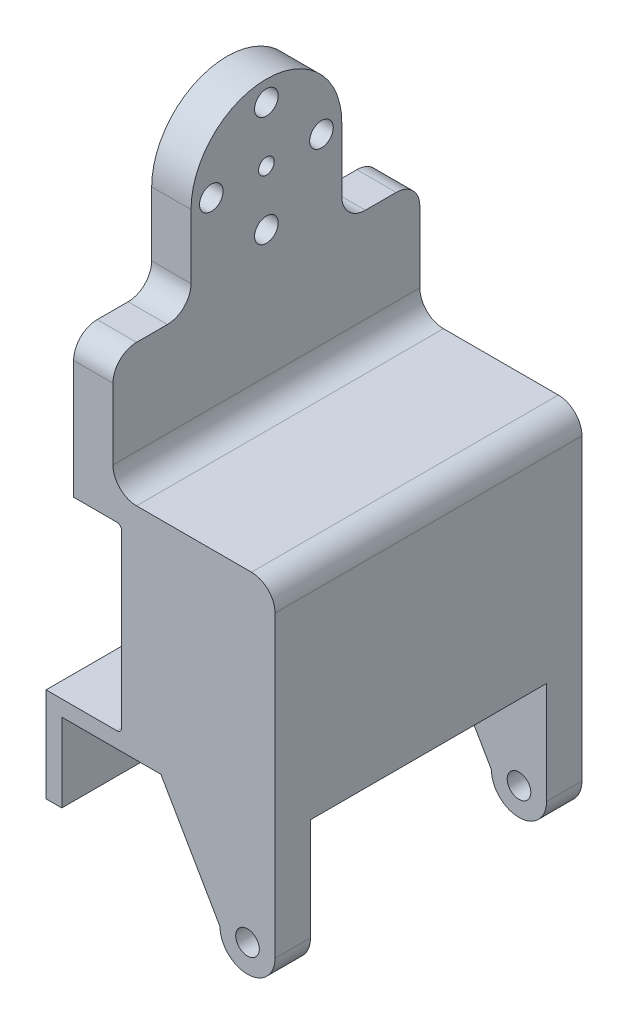
from build123d import *

# Parameters (mm, degrees)
BOSS_EXTRUDE1_DEPTH      = 19.5
SKETCH3_W                = 2
SKETCH3_H                = 39
BOSS_EXTRUDE2_DEPTH      = 10
SKETCH4_R                = 2.5
CUT_EXTRUDE3_DEPTH       = 10
SKETCH5_W                = 5.1
SKETCH5_H                = 22.95
BOSS_EXTRUDE3_DEPTH      = 25.1
SKETCH8_W                = 15.5
SKETCH8_H                = 22.95
BOSS_EXTRUDE4_DEPTH      = 33.9
BOSS_EXTRUDE5_DEPTH      = 19.5
SKETCH12_W               = 30.263636296
SKETCH12_H               = 30
CUT_EXTRUDE6_DEPTH       = 16.5
SKETCH13_R               = 1.5
CUT_EXTRUDE7_DEPTH       = 64.966273157
FILLET3_R                = 3
SKETCH16_W               = 39
SKETCH16_H               = 3.05
BOSS_EXTRUDE6_DEPTH      = 25.1
SKETCH17_W               = 5
SKETCH17_H               = 39
BOSS_EXTRUDE7_DEPTH      = 15
FILLET4_R                = 3
FILLET11_R               = 0.6
FILLET12_R               = 0.6
SKETCH18_W               = 5
SKETCH18_H               = 19.16
BOSS_EXTRUDE12_DEPTH     = 25.725
CUT_EXTRUDE13_DEPTH      = 73.504038681
CUT_EXTRUDE13_DEPTH_BACK = 73.504038681
CUT_EXTRUDE14_DEPTH      = 73.504038681
FILLET15_R               = 3
FILLET16_R               = 3
FILLET17_R               = 3
FILLET18_R               = 3
SKETCH23_W               = 3.5
SKETCH23_H               = 39
CUT_EXTRUDE15_DEPTH      = 26


with BuildPart() as part:
    # Sketch1 → Boss-Extrude1 (new, symmetric)
    with BuildSketch(Plane.XY):
        Polygon((-18.427969187, 26), (-18.427969187, 0), (-43.527969187, 0), (-43.527969187, -2), (-14.427969187, -2), (-14.427969187, 26), align=None)
    extrude(amount=BOSS_EXTRUDE1_DEPTH, both=True)

    # Sketch3 → Boss-Extrude2 (add)
    with BuildSketch(Plane(origin=(0, -2, 0), x_dir=(1, 0, 0), z_dir=(0, 1, 0))):
        with Locations((-42.527969187, 0)):
            Rectangle(SKETCH3_W, SKETCH3_H)
    extrude(amount=-BOSS_EXTRUDE2_DEPTH)

    # Sketch4 → Cut-Extrude3 (cut)
    with BuildSketch(Plane(origin=(-41.527969187, 0, 0), x_dir=(0, 0, -1), z_dir=(1, 0, 0))):
        with Locations((0, -7)):
            Circle(SKETCH4_R)
    extrude(amount=-CUT_EXTRUDE3_DEPTH, mode=Mode.SUBTRACT)

    # Sketch5 → Boss-Extrude3 (add)
    with BuildSketch(Plane.ZY.offset(18.427969187)):
        with Locations((-16.95, 11.475)):
            Rectangle(SKETCH5_W, SKETCH5_H)
    extrude(amount=BOSS_EXTRUDE3_DEPTH)

    # Sketch8 → Boss-Extrude4 (add)
    with BuildSketch(Plane.XY.offset(-14.4)):
        with Locations((-26.177969187, 11.475)):
            Rectangle(SKETCH8_W, SKETCH8_H)
    extrude(amount=BOSS_EXTRUDE4_DEPTH)

    # Sketch11 → Boss-Extrude5 (add, symmetric)
    with BuildSketch(Plane.XY):
        with BuildLine():
            Line((-14.427969187, -2), (-14.427969187, -15))
            ThreePointArc((-14.427969187, -15), (-17.927969187, -18.5), (-21.427969187, -15))
            Line((-21.427969187, -15), (-28.933522687, -2))
            Line((-28.933522687, -2), (-14.427969187, -2))
        make_face()
    extrude(amount=BOSS_EXTRUDE5_DEPTH, both=True)

    # Sketch12 → Cut-Extrude6 (cut)
    with BuildSketch(Plane(origin=(0, -18.5, 0), x_dir=(1, 0, 0), z_dir=(0, 1, 0))):
        with Locations((-18.965310336, 0)):
            Rectangle(SKETCH12_W, SKETCH12_H)
    extrude(amount=CUT_EXTRUDE6_DEPTH, mode=Mode.SUBTRACT)

    # Sketch13 → Cut-Extrude7 (cut, through all)
    with BuildSketch(Plane.XY.offset(19.5)):
        with Locations((-17.927969187, -15)):
            Circle(SKETCH13_R)
    extrude(amount=-CUT_EXTRUDE7_DEPTH, mode=Mode.SUBTRACT)

    # Fillet3
    fillet3_edges = [part.edges().sort_by_distance(p)[0] for p in [
        (-14.427969187, 26, 0),
    ]]
    fillet(fillet3_edges, radius=FILLET3_R)

    # Sketch16 → Boss-Extrude6 (add)
    with BuildSketch(Plane.ZY.offset(18.427969187)):
        with Locations((0, 24.475)):
            Rectangle(SKETCH16_W, SKETCH16_H)
    extrude(amount=BOSS_EXTRUDE6_DEPTH)

    # Sketch17 → Boss-Extrude7 (add)
    with BuildSketch(Plane(origin=(0, 26, 0), x_dir=(1, 0, 0), z_dir=(0, 1, 0))):
        with Locations((-37.527969187, 0)):
            Rectangle(SKETCH17_W, SKETCH17_H)
    extrude(amount=BOSS_EXTRUDE7_DEPTH)

    # Fillet4
    fillet4_edges = [part.edges().sort_by_distance(p)[0] for p in [
        (-35.027969187, 26, 0),
    ]]
    fillet(fillet4_edges, radius=FILLET4_R)

    # Fillet11
    fillet11_edges = [part.edges().sort_by_distance(p)[0] for p in [
        (-33.927969187, 22.95, 2.55),
    ]]
    fillet(fillet11_edges, radius=FILLET11_R)

    # Fillet12
    fillet12_edges = [part.edges().sort_by_distance(p)[0] for p in [
        (-33.927969187, 0, 2.55),
    ]]
    fillet(fillet12_edges, radius=FILLET12_R)

    # Sketch18 → Boss-Extrude12 (add)
    with BuildSketch(Plane(origin=(0, 41, 0), x_dir=(1, 0, 0), z_dir=(0, 1, 0))):
        with Locations((-37.527969187, 0)):
            Rectangle(SKETCH18_W, SKETCH18_H)
    extrude(amount=BOSS_EXTRUDE12_DEPTH)

    # Sketch20 → Cut-Extrude13 (cut, two sides: drawn at the far end of the back side and taken through both)
    with BuildSketch(Plane(origin=(-35.027969187, 0, 0), x_dir=(0, 0, -1), z_dir=(1, 0, 0)).offset(-CUT_EXTRUDE13_DEPTH_BACK)):
        with BuildLine():
            ThreePointArc((0, 46.65), (-1.5, 45.15), (0, 43.65))
            ThreePointArc((0, 43.65), (1.5, 45.15), (0, 46.65))
        make_face()
        with BuildLine():
            ThreePointArc((-7, 53.65), (-8.5, 52.15), (-7, 50.65))
            ThreePointArc((-7, 50.65), (-5.939339828, 51.089339828), (-5.5, 52.15))
            ThreePointArc((-5.5, 52.15), (-5.939339828, 53.210660172), (-7, 53.65))
        make_face()
        with BuildLine():
            ThreePointArc((0, 60.65), (-1.5, 59.15), (0, 57.65))
            ThreePointArc((0, 57.65), (1.5, 59.15), (0, 60.65))
        make_face()
        with BuildLine():
            ThreePointArc((7, 53.65), (5.939959741, 53.211279722), (5.500001024, 52.151752864))
            ThreePointArc((5.500001024, 52.151752864), (5.938720278, 51.089959741), (7, 50.65))
            ThreePointArc((7, 50.65), (8.5, 52.15), (7, 53.65))
        make_face()
        with BuildLine():
            ThreePointArc((1, 52.15), (0, 53.15), (-1, 52.15))
            ThreePointArc((-1, 52.15), (0, 51.15), (1, 52.15))
        make_face()
    extrude(amount=CUT_EXTRUDE13_DEPTH + CUT_EXTRUDE13_DEPTH_BACK, mode=Mode.SUBTRACT)

    # Sketch21 → Cut-Extrude14 (cut, through all)
    with BuildSketch(Plane(origin=(-35.027969187, 0, 0), x_dir=(0, 0, -1), z_dir=(1, 0, 0))):
        with BuildLine():
            Line((-9.58, 66.725), (9.58, 66.725))
            Line((9.58, 66.725), (9.58, 52.15))
            ThreePointArc((9.58, 52.15), (0, 61.73), (-9.58, 52.15))
            Line((-9.58, 52.15), (-9.58, 66.725))
        make_face()
    extrude(amount=-CUT_EXTRUDE14_DEPTH, mode=Mode.SUBTRACT)

    # Fillet15
    fillet15_edges = [part.edges().sort_by_distance(p)[0] for p in [
        (-37.527969187, 41, 9.58),
    ]]
    fillet(fillet15_edges, radius=FILLET15_R)

    # Fillet16
    fillet16_edges = [part.edges().sort_by_distance(p)[0] for p in [
        (-37.527969187, 41, 19.5),
    ]]
    fillet(fillet16_edges, radius=FILLET16_R)

    # Fillet17
    fillet17_edges = [part.edges().sort_by_distance(p)[0] for p in [
        (-37.527969187, 41, -19.5),
    ]]
    fillet(fillet17_edges, radius=FILLET17_R)

    # Fillet18
    fillet18_edges = [part.edges().sort_by_distance(p)[0] for p in [
        (-37.527969187, 41, -9.58),
    ]]
    fillet(fillet18_edges, radius=FILLET18_R)

    # Sketch23 → Cut-Extrude15 (cut)
    with BuildSketch(Plane(origin=(0, 26, 0), x_dir=(1, 0, 0), z_dir=(0, 1, 0))):
        with Locations((-41.777969187, 0)):
            Rectangle(SKETCH23_W, SKETCH23_H)
    extrude(amount=-CUT_EXTRUDE15_DEPTH, mode=Mode.SUBTRACT)


solid = part.part
